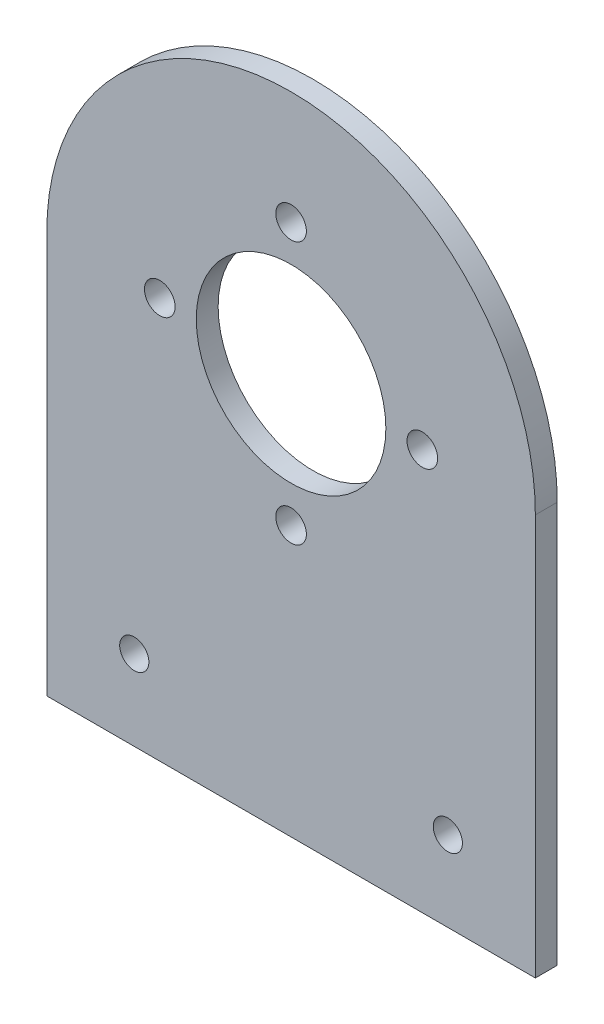
from build123d import *

# Parameters (mm, degrees)
SKETCH1_R           = 13
SKETCH1_R_2         = 2.1
SKETCH1_R_3         = 2
BOSS_EXTRUDE1_DEPTH = 3


with BuildPart() as part:
    # Sketch1 → Boss-Extrude1 (new body)
    with BuildSketch(Plane.XY):
        with BuildLine():
            Line((-33.5, 0), (33.5, 0))
            Line((33.5, 0), (33.5, 55))
            ThreePointArc((33.5, 55), (0, 88.5), (-33.5, 55))
            Line((-33.5, 55), (-33.5, 0))
        make_face()
        with Locations((0, 55)):
            Circle(SKETCH1_R, mode=Mode.SUBTRACT)
        with Locations((0, 37)):
            Circle(SKETCH1_R_2, mode=Mode.SUBTRACT)
        with Locations((-21.5, 11)):
            Circle(SKETCH1_R_3, mode=Mode.SUBTRACT)
        with Locations((21.5, 11)):
            Circle(SKETCH1_R_3, mode=Mode.SUBTRACT)
        with Locations((-18, 55)):
            Circle(SKETCH1_R_2, mode=Mode.SUBTRACT)
        with Locations((0, 73)):
            Circle(SKETCH1_R_2, mode=Mode.SUBTRACT)
        with Locations((18, 55)):
            Circle(SKETCH1_R_2, mode=Mode.SUBTRACT)
    extrude(amount=BOSS_EXTRUDE1_DEPTH)


solid = part.part
